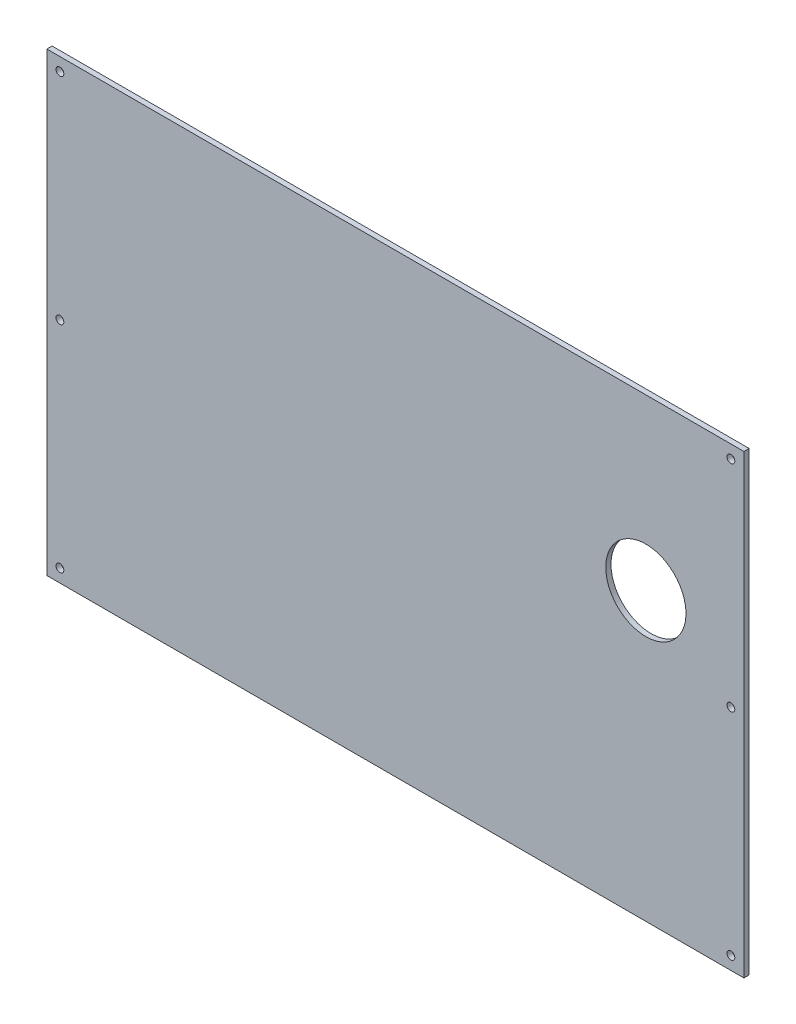
from build123d import *

# Parameters (mm, degrees)
SKICA1_W                 = 535
SKICA1_H                 = 350
SKICA1_R                 = 3
P_IDAT_VYSUNUT_M1_DEPTH  = 4
SKICA2_R                 = 30.776653742
ODEBRAT_VYSUNUT_M1_DEPTH = 4


with BuildPart() as part:
    # Skica1 → Přidat vysunutím1 (new body)
    with BuildSketch(Plane.XY):
        Rectangle(SKICA1_W, SKICA1_H)
        with Locations((-257.5, 165)):
            Circle(SKICA1_R, mode=Mode.SUBTRACT)
        with Locations((-257.5, 0)):
            Circle(SKICA1_R, mode=Mode.SUBTRACT)
        with Locations((-257.5, -165)):
            Circle(SKICA1_R, mode=Mode.SUBTRACT)
        with Locations((257.5, 165)):
            Circle(SKICA1_R, mode=Mode.SUBTRACT)
        with Locations((257.5, 0)):
            Circle(SKICA1_R, mode=Mode.SUBTRACT)
        with Locations((257.5, -165)):
            Circle(SKICA1_R, mode=Mode.SUBTRACT)
    extrude(amount=P_IDAT_VYSUNUT_M1_DEPTH)

    # Skica2 → Odebrat vysunutím1 (cut)
    with BuildSketch(Plane(origin=(0, 0, 0), x_dir=(-1, 0, 0), z_dir=(0, 0, -1))):
        with Locations((-192.248320425, 45.04602447)):
            Circle(SKICA2_R)
    extrude(amount=-ODEBRAT_VYSUNUT_M1_DEPTH, mode=Mode.SUBTRACT)


solid = part.part
